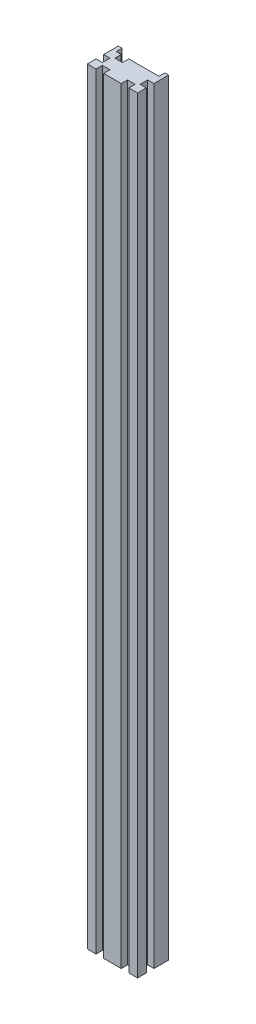
from build123d import *

# Parameters (mm, degrees)
SKETCH1_W           = 40
SKETCH1_H           = 20
BOSS_EXTRUDE1_DEPTH = 609.6
SKETCH2_W           = 6
SKETCH2_H           = 609.6
CUT_EXTRUDE1_DEPTH  = 5
SKETCH3_W           = 6
SKETCH3_H           = 609.6
CUT_EXTRUDE2_DEPTH  = 5
SKETCH4_W           = 6
SKETCH4_H           = 609.6
CUT_EXTRUDE3_DEPTH  = 5
SKETCH5_W           = 6
SKETCH5_H           = 609.6
CUT_EXTRUDE4_DEPTH  = 5
SKETCH6_W           = 3
SKETCH6_H           = 609.6
BOSS_EXTRUDE2_DEPTH = 4.75


with BuildPart() as part:
    # Sketch1 → Boss-Extrude1 (new body)
    with BuildSketch(Plane(origin=(0, 0, 0), x_dir=(1, 0, 0), z_dir=(0, 1, 0))):
        with Locations((20, 10)):
            Rectangle(SKETCH1_W, SKETCH1_H)
    extrude(amount=BOSS_EXTRUDE1_DEPTH)

    # Sketch2 → Cut-Extrude1 (cut)
    with BuildSketch(Plane.XY):
        with Locations((10, 304.8)):
            Rectangle(SKETCH2_W, SKETCH2_H)
        with Locations((30, 304.8)):
            Rectangle(SKETCH2_W, SKETCH2_H)
    extrude(amount=-CUT_EXTRUDE1_DEPTH, mode=Mode.SUBTRACT)

    # Sketch3 → Cut-Extrude2 (cut)
    with BuildSketch(Plane.ZY):
        with Locations((-10, 304.8)):
            Rectangle(SKETCH3_W, SKETCH3_H)
    extrude(amount=-CUT_EXTRUDE2_DEPTH, mode=Mode.SUBTRACT)

    # Sketch4 → Cut-Extrude3 (cut)
    with BuildSketch(Plane(origin=(40, 0, 0), x_dir=(0, 0, -1), z_dir=(1, 0, 0))):
        with Locations((10, 304.8)):
            Rectangle(SKETCH4_W, SKETCH4_H)
    extrude(amount=-CUT_EXTRUDE3_DEPTH, mode=Mode.SUBTRACT)

    # Sketch5 → Cut-Extrude4 (cut)
    with BuildSketch(Plane(origin=(0, 0, -20), x_dir=(-1, 0, 0), z_dir=(0, 0, -1))):
        with Locations((-10, 304.8)):
            Rectangle(SKETCH5_W, SKETCH5_H)
    extrude(amount=-CUT_EXTRUDE4_DEPTH, mode=Mode.SUBTRACT)

    # Sketch6 → Boss-Extrude2 (add)
    with BuildSketch(Plane(origin=(0, 0, -20), x_dir=(-1, 0, 0), z_dir=(0, 0, -1))):
        with Locations((-38.5, 304.8)):
            Rectangle(SKETCH6_W, SKETCH6_H)
        with Locations((-1.5, 304.8)):
            Rectangle(SKETCH6_W, SKETCH6_H)
    extrude(amount=BOSS_EXTRUDE2_DEPTH)


solid = part.part
